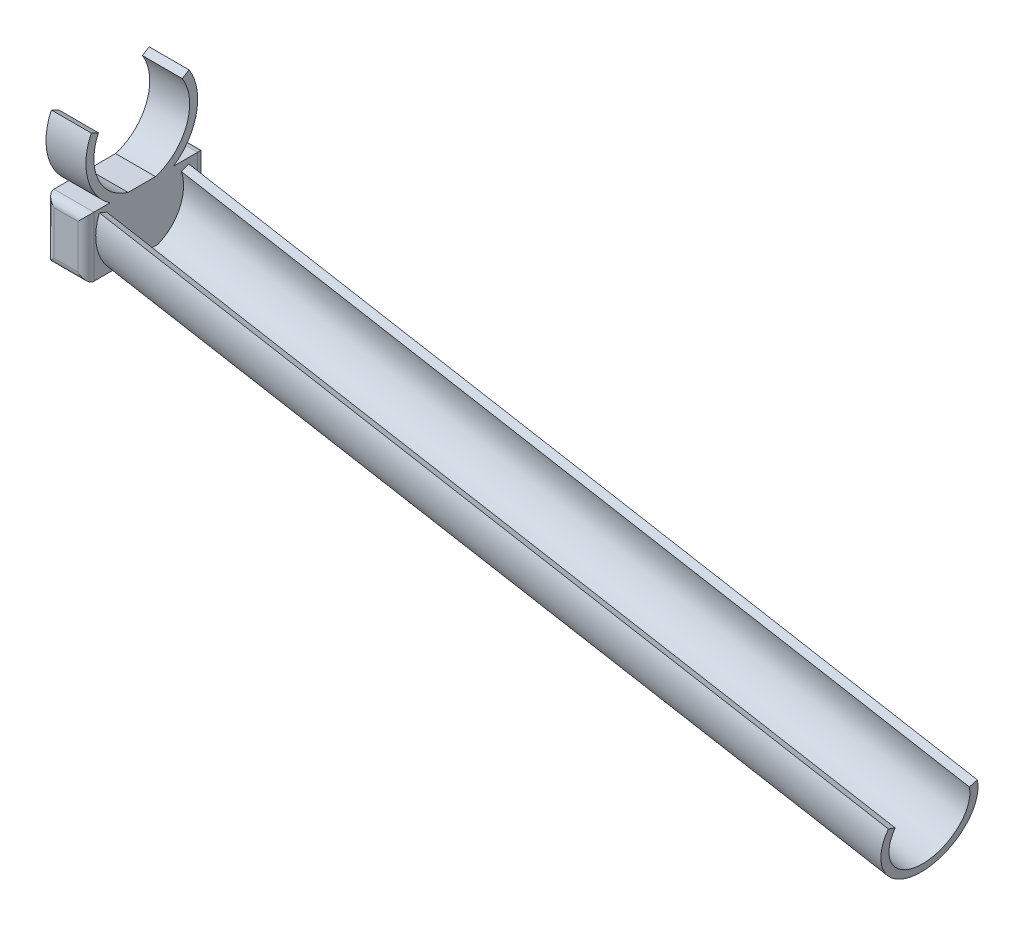
from build123d import *

# Parameters (mm, degrees)
EXTRUDE_1_DEPTH      = 10
SKETCH_2_W           = 10
SKETCH_2_H           = 30
EXTRUDE_1_2_DEPTH    = 2.5
EXTRUDE_4_DEPTH      = 200
EXTRUDE_4_DEPTH_BACK = 1
SKETCH_8_W           = 10
SKETCH_8_H           = 30
EXTRUDE_2_DEPTH      = 10
FILLET_2_R           = 2


with BuildPart() as part:
    # 草图1 → Extrude 1 (new body)
    with BuildSketch(Plane(origin=(0, 0, 0), x_dir=(0, 0, -1), z_dir=(1, 0, 0))):
        with BuildLine():
            ThreePointArc((-10.846142842, 5.134314505), (0.719237504, -11.978426333), (10.153857158, 6.39524705))
            Line((10.153857158, 6.39524705), (11.846166684, 7.461121558))
            ThreePointArc((11.846166684, 7.461121558), (0.839110422, -13.974830722), (-12.653833316, 5.99003359))
            Line((-12.653833316, 5.99003359), (-10.846142842, 5.134314505))
        make_face()
    extrude(amount=EXTRUDE_1_DEPTH)

    # 草图2 → Extrude 1 2 (add, symmetric)
    with BuildSketch(Plane(origin=(0, -14, 0), x_dir=(-1, 0, 0), z_dir=(0, -1, 0))):
        with Locations((-5, 1)):
            Rectangle(SKETCH_2_W, SKETCH_2_H)
    extrude(amount=EXTRUDE_1_2_DEPTH, both=True)



with BuildPart() as body_2:
    # 草图6 → 拉伸-薄壁4 (new, two sides: drawn at the far end of the back side and taken through both)
    with BuildSketch(Plane(origin=(12.520129286, -2.207636595, 0), x_dir=(0, 0, 1), z_dir=(0.984807753012208, -0.17364817766693072, 0)).offset(-EXTRUDE_4_DEPTH_BACK)):
        with BuildLine():
            ThreePointArc((-11.782684324, 11.014511571), (-0.139277573, 26.995609574), (10.62288968, 10.40825987))
            Line((10.62288968, 10.40825987), (8.775098788, 11.173549892))
            ThreePointArc((8.775098788, 11.173549892), (-0.193373923, 24.996341312), (-9.896212883, 11.678759642))
            Line((-9.896212883, 11.678759642), (-11.782684324, 11.014511571))
        make_face()
    extrude(amount=EXTRUDE_4_DEPTH + EXTRUDE_4_DEPTH_BACK)


with BuildPart() as part_1:
    add(part.part)

    add(body_2.part)  # 凸台-拉伸2 merges body 2
    # 草图8 → 凸台-拉伸2 (add)
    with BuildSketch(Plane.XZ.offset(16.5)):
        with Locations((5, -1)):
            Rectangle(SKETCH_8_W, SKETCH_8_H)
    extrude(amount=EXTRUDE_2_DEPTH)

    # 圆角2
    fillet_2_edges = [part_1.edges().sort_by_distance(p)[0] for p in [
        (10, -19, -16),
        (5, -11.5, 14),
        (10, -19, 14),
        (0, -19, 14),
        (5, -11.5, -16),
        (0, -19, -16),
        (5, -26.5, -16),
        (5, -26.5, 14),
    ]]
    fillet(fillet_2_edges, radius=FILLET_2_R)


solid = part_1.part
